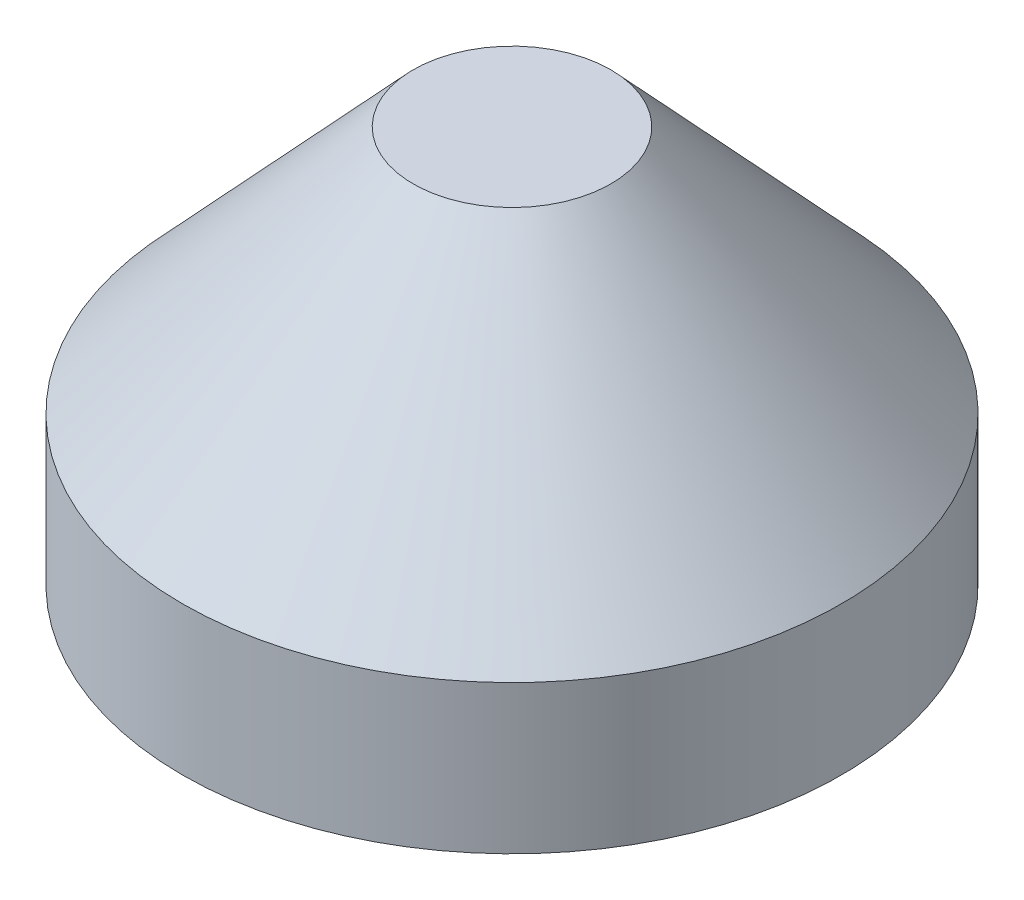
from build123d import *


with BuildPart() as part:
    # Sketch1 → Revolve1 (revolve)
    with BuildSketch(Plane.XY, mode=Mode.PRIVATE) as revolve1_sk:
        Polygon((-6, 2.7), (-6, 0), (0, 0), (0, 7.22), (-1.8, 7.22), align=None)
    revolve(revolve1_sk.sketch.rotate(Axis((0, 0, 0), (0, 1, 0)), 270), axis=Axis((0, 0, 0), (0, 1, 0)))


solid = part.part
